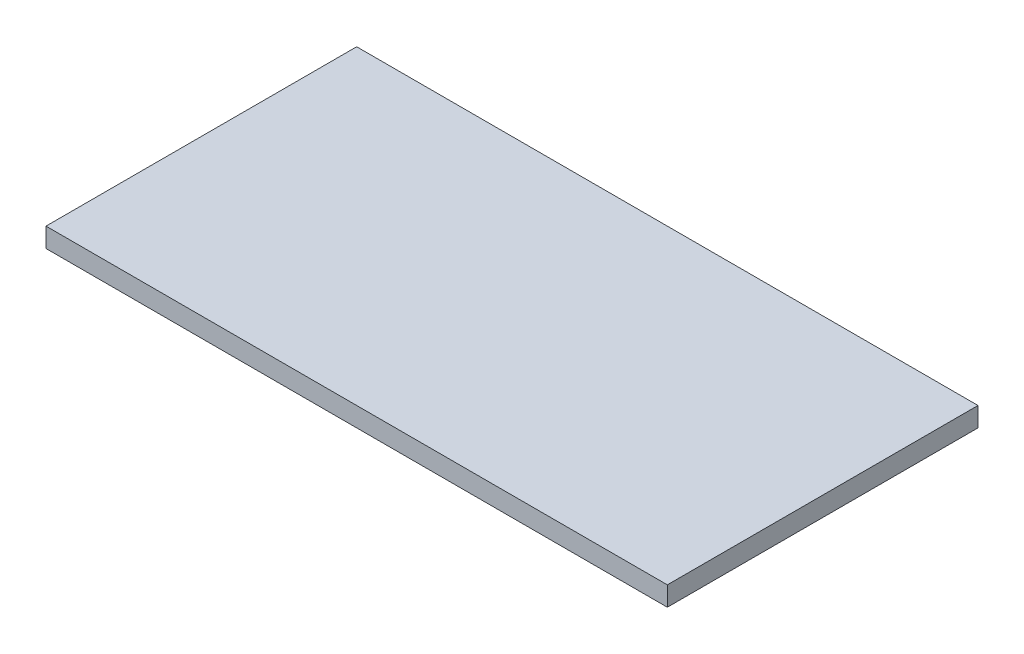
from build123d import *

# Parameters (mm, degrees)
SKETCH_1_W      = 160
SKETCH_1_H      = 80
EXTRUDE_1_DEPTH = 5


with BuildPart() as part:
    # 草图1 → 凸台-拉伸1 (new body)
    with BuildSketch(Plane(origin=(0, 0, 0), x_dir=(1, 0, 0), z_dir=(0, 1, 0))):
        Rectangle(SKETCH_1_W, SKETCH_1_H)
    extrude(amount=EXTRUDE_1_DEPTH)


solid = part.part
